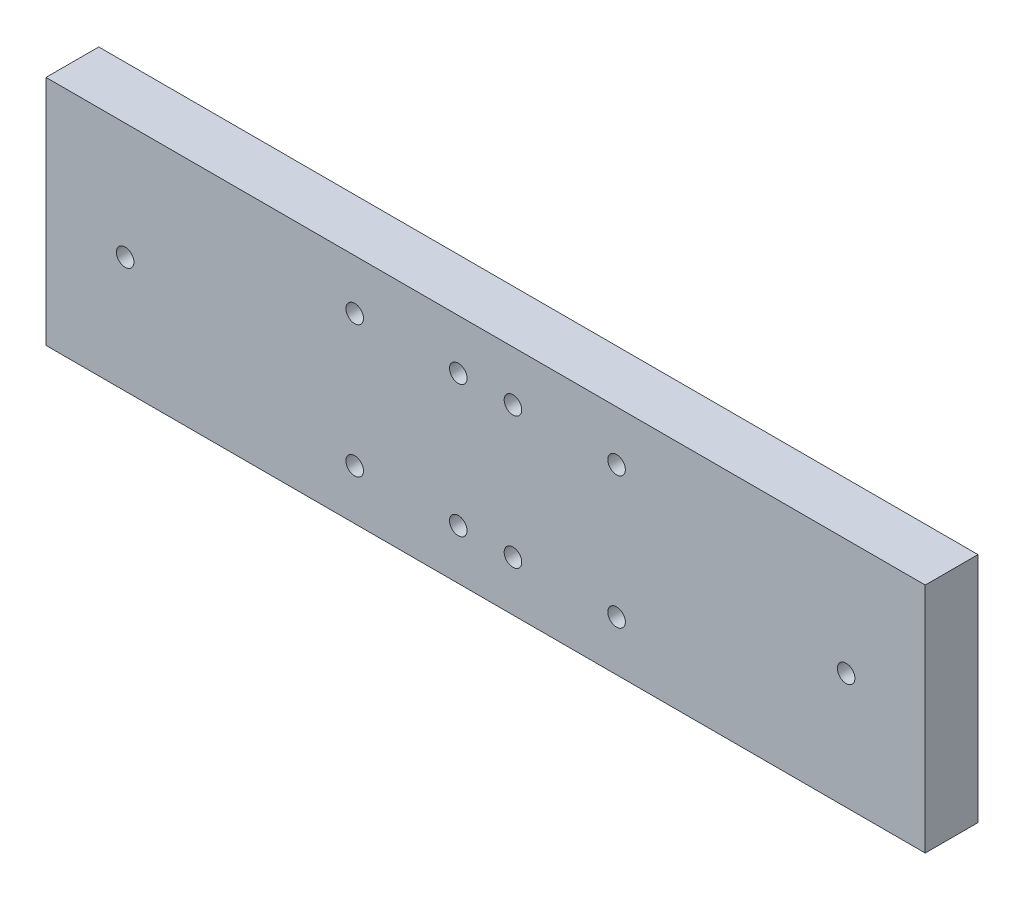
from build123d import *

# Parameters (mm, degrees)
SKETCH1_W           = 250
SKETCH1_H           = 66
SKETCH1_R           = 2.5
BOSS_EXTRUDE1_DEPTH = 15


with BuildPart() as part:
    # Sketch1 → Boss-Extrude1 (new body)
    with BuildSketch(Plane.XY):
        with Locations((-22.5, -38.75)):
            Rectangle(SKETCH1_W, SKETCH1_H)
        with Locations((14.728679071, -20)):
            Circle(SKETCH1_R, mode=Mode.SUBTRACT)
        with Locations((14.728679071, -57.5)):
            Circle(SKETCH1_R, mode=Mode.SUBTRACT)
        with Locations((-14.728679071, -57.5)):
            Circle(SKETCH1_R, mode=Mode.SUBTRACT)
        with Locations((-14.728679071, -20)):
            Circle(SKETCH1_R, mode=Mode.SUBTRACT)
        with Locations((-30.271320929, -20)):
            Circle(SKETCH1_R, mode=Mode.SUBTRACT)
        with Locations((-30.271320929, -57.5)):
            Circle(SKETCH1_R, mode=Mode.SUBTRACT)
        with Locations((-59.728679071, -57.5)):
            Circle(SKETCH1_R, mode=Mode.SUBTRACT)
        with Locations((-59.728679071, -20)):
            Circle(SKETCH1_R, mode=Mode.SUBTRACT)
        with Locations((80, -38.75)):
            Circle(SKETCH1_R, mode=Mode.SUBTRACT)
        with Locations(Location((-125, -38.75, 0), (0, 0, 180))):
            Circle(SKETCH1_R, mode=Mode.SUBTRACT)
    extrude(amount=BOSS_EXTRUDE1_DEPTH)


solid = part.part
